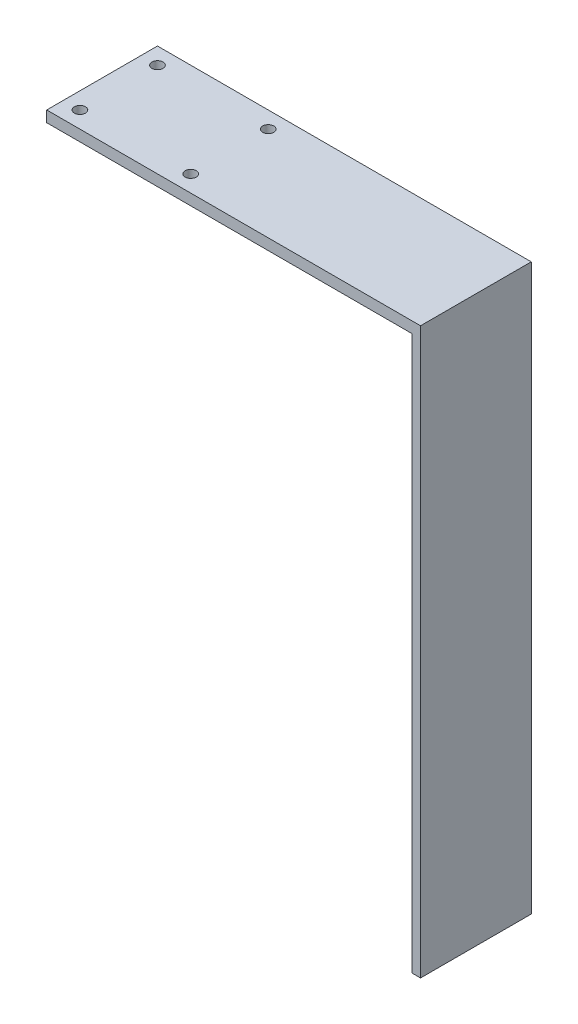
from build123d import *

# Parameters (mm, degrees)
SKETCH1_W           = 135
SKETCH1_H           = 40
SKETCH1_R           = 2
BOSS_EXTRUDE1_DEPTH = 4
SKETCH3_W           = 3
SKETCH3_H           = 40
BOSS_EXTRUDE3_DEPTH = 200


with BuildPart() as part:
    # Sketch1 → Boss-Extrude1 (new body)
    with BuildSketch(Plane(origin=(0, 0, 0), x_dir=(1, 0, 0), z_dir=(0, 1, 0))):
        Rectangle(SKETCH1_W, SKETCH1_H)
        with Locations(Location((-21.5, 14, 0), (0, 0, 270))):
            Circle(SKETCH1_R, mode=Mode.SUBTRACT)
        with Locations(Location((-21.5, -14, 0), (0, 0, 270))):
            Circle(SKETCH1_R, mode=Mode.SUBTRACT)
        with Locations(Location((-61.5, -14, 0), (0, 0, 270))):
            Circle(SKETCH1_R, mode=Mode.SUBTRACT)
        with Locations(Location((-61.5, 14, 0), (0, 0, 270))):
            Circle(SKETCH1_R, mode=Mode.SUBTRACT)
    extrude(amount=BOSS_EXTRUDE1_DEPTH)

    # Sketch3 → Boss-Extrude3 (add)
    with BuildSketch(Plane.XZ):
        with Locations((66, 0)):
            Rectangle(SKETCH3_W, SKETCH3_H)
    extrude(amount=BOSS_EXTRUDE3_DEPTH)


solid = part.part
